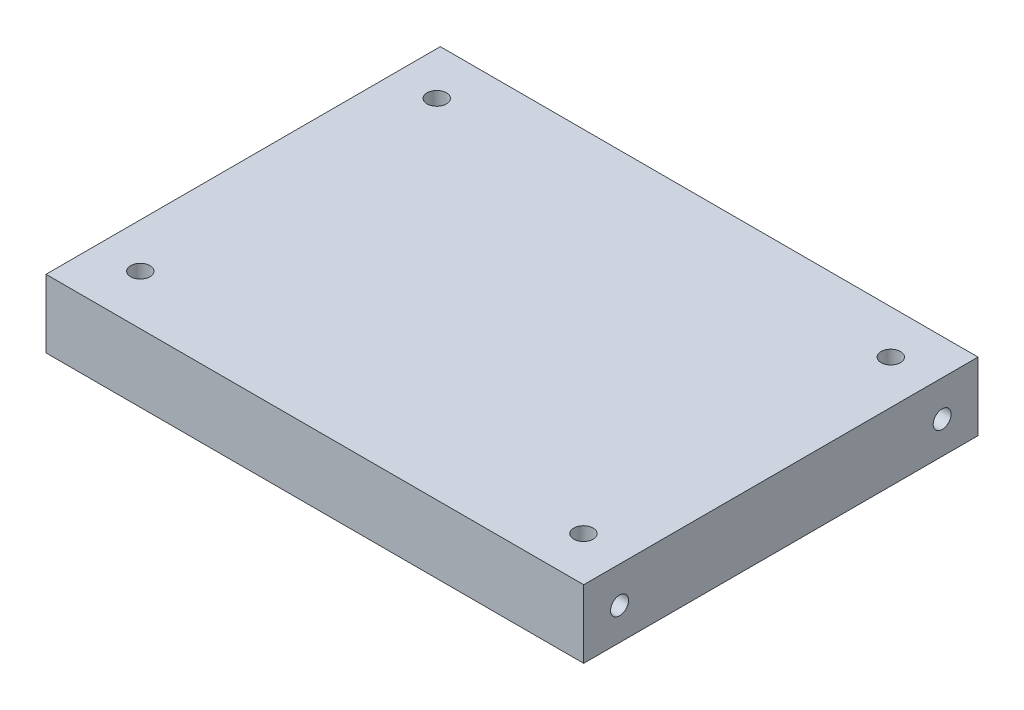
from build123d import *

# Parameters (mm, degrees)
SKETCH1_W                      = 75
SKETCH1_H                      = 55
BOSS_EXTRUDE1_DEPTH            = 9.5
SKETCH2_R                      = 1.35
CUT_EXTRUDE1_DEPTH             = 10
M3X0_5_TAPPED_HOLE2_AT_2_COUNT = 2
M3X0_5_TAPPED_HOLE2_AT_2_PITCH = 45


with BuildPart() as part:
    # Sketch1 → Boss-Extrude1 (new body)
    with BuildSketch(Plane(origin=(0, 0, 0), x_dir=(1, 0, 0), z_dir=(0, 1, 0))):
        Rectangle(SKETCH1_W, SKETCH1_H)
    extrude(amount=BOSS_EXTRUDE1_DEPTH)

    # Sketch2 → Cut-Extrude1 (cut)
    with BuildSketch(Plane(origin=(0, 9.5, 0), x_dir=(1, 0, 0), z_dir=(0, 1, 0))):
        with Locations(Location((-31.5, 21, 0), (0, 0, 270))):
            Circle(SKETCH2_R)
        with Locations(Location((31.420574921, 21.415697585, 0), (0, 0, 270))):
            Circle(SKETCH2_R)
        with Locations(Location((31.306542661, -21.346400068, 0), (0, 0, 270))):
            Circle(SKETCH2_R)
        with Locations(Location((-31.297168302, -20.548174245, 0), (0, 0, 270))):
            Circle(SKETCH2_R)
    extrude(amount=-CUT_EXTRUDE1_DEPTH, mode=Mode.SUBTRACT)

    # Sketch5 → M3x0.5 Tapped Hole2 (revolve, cut)
    with BuildSketch(Plane(origin=(-37.5, 4.5, -22.5), x_dir=(0, 0, 1), z_dir=(0, 1, 0))):
        Polygon((0, 0), (0, 3.751075774), (1.25, 3), (1.25, 0), align=None)
    m3x0_5_tapped_hole2 = revolve(axis=Axis((-43.85, 4.5, -22.5), (1, 0, 0)), mode=Mode.SUBTRACT)

    # M3x0.5 Tapped Hole2 at 2: M3x0.5 Tapped Hole2 ×2
    with Locations(*[(0, 0, i * M3X0_5_TAPPED_HOLE2_AT_2_PITCH) for i in range(1, M3X0_5_TAPPED_HOLE2_AT_2_COUNT)]):
        add(m3x0_5_tapped_hole2, mode=Mode.SUBTRACT)

    # Mirror1: M3x0.5 Tapped Hole2 across plane
    add(m3x0_5_tapped_hole2.mirror(Plane.ZY), mode=Mode.SUBTRACT)

    # Mirror1 copy 1 sketch → Mirror1 copy 1 (revolve, cut)
    with BuildSketch(Plane(origin=(37.5, 4.5, 22.5), x_dir=(0, 0, 1), z_dir=(0, 1, 0))):
        Polygon((0, 0), (0, -3.751075774), (1.25, -3), (1.25, 0), align=None)
    revolve(axis=Axis((43.85, 4.5, 22.5), (1, 0, 0)), mode=Mode.SUBTRACT)


solid = part.part
